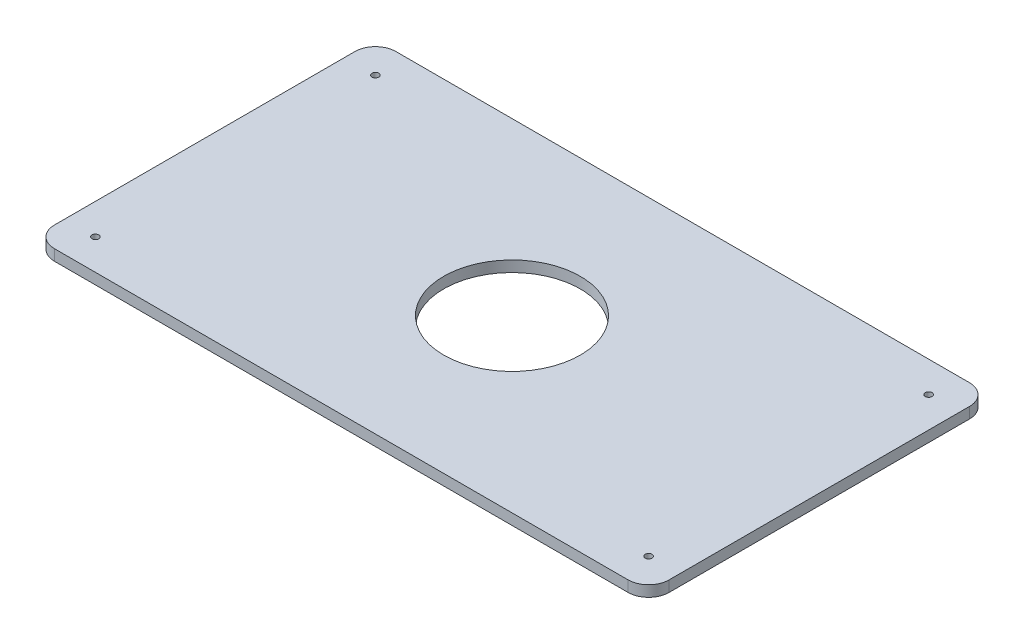
from build123d import *

# Parameters (mm, degrees)
CROQUIS1_R              = 50
CROQUIS1_R_2            = 2.5
SALIENTE_EXTRUIR1_DEPTH = 8


with BuildPart() as part:
    # Croquis1 → Saliente-Extruir1 (new body)
    with BuildSketch(Plane(origin=(0, 0, 0), x_dir=(1, 0, 0), z_dir=(0, 1, 0))):
        with BuildLine():
            Line((15, 0), (435, 0))
            ThreePointArc((435, 0), (445.606601718, 4.393398282), (450, 15))
            Line((450, 15), (450, 235))
            ThreePointArc((450, 235), (445.606601718, 245.606601718), (435, 250))
            Line((435, 250), (15, 250))
            ThreePointArc((15, 250), (4.393398282, 245.606601718), (0, 235))
            Line((0, 235), (0, 15))
            ThreePointArc((0, 15), (4.393398282, 4.393398282), (15, 0))
        make_face()
        with Locations(Location((225, 125, 0), (0, 0, 270))):
            Circle(CROQUIS1_R, mode=Mode.SUBTRACT)
        with Locations(Location((22.5, 227.5, 0), (0, 0, 270))):
            Circle(CROQUIS1_R_2, mode=Mode.SUBTRACT)
        with Locations(Location((427.5, 227.5, 0), (0, 0, 270))):
            Circle(CROQUIS1_R_2, mode=Mode.SUBTRACT)
        with Locations(Location((427.5, 22.5, 0), (0, 0, 270))):
            Circle(CROQUIS1_R_2, mode=Mode.SUBTRACT)
        with Locations(Location((22.5, 22.5, 0), (0, 0, 270))):
            Circle(CROQUIS1_R_2, mode=Mode.SUBTRACT)
    extrude(amount=SALIENTE_EXTRUIR1_DEPTH)


solid = part.part
